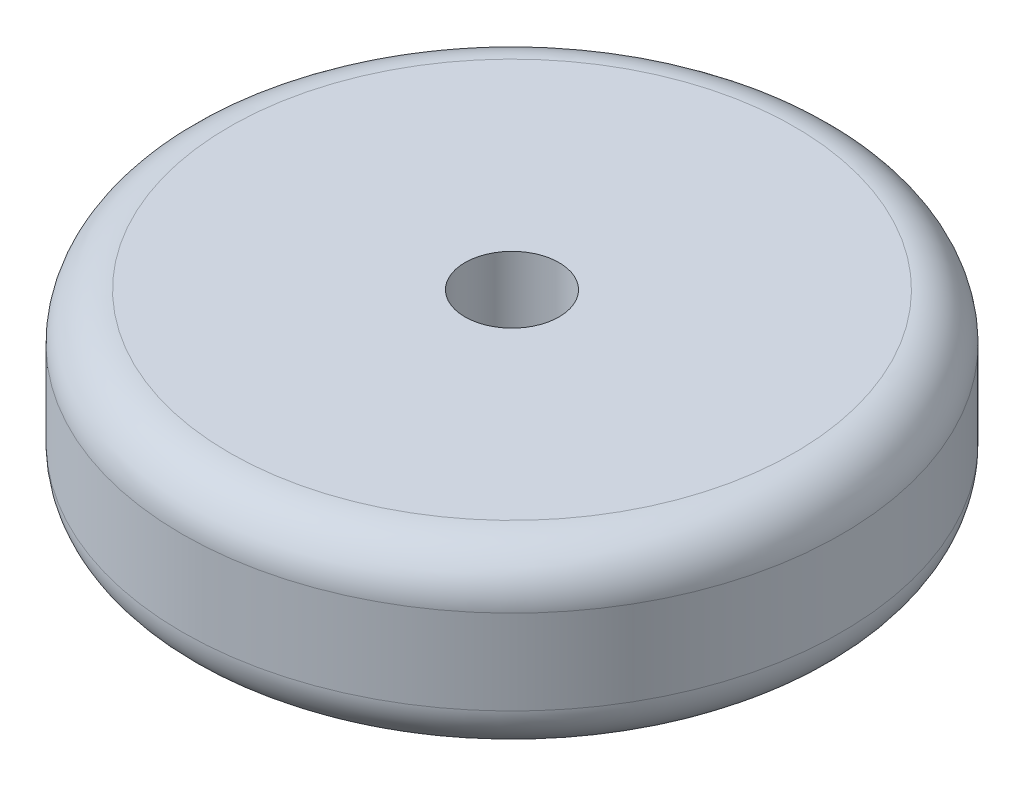
from build123d import *

# Parameters (mm, degrees)
ESBO_O1_R                = 3.5
RESSALTO_EXTRUS_O1_DEPTH = 1.9
ESBO_O2_R                = 0.5
CORTE_EXTRUS_O1_DEPTH    = 1.9
FILETE1_R                = 0.5


with BuildPart() as part:
    # Esboço1 → Ressalto-extrusão1 (new body)
    with BuildSketch(Plane(origin=(0, 0, 0), x_dir=(1, 0, 0), z_dir=(0, 1, 0))):
        with Locations(Location((0, 0, 0), (0, 0, 90))):
            Circle(ESBO_O1_R)
    extrude(amount=RESSALTO_EXTRUS_O1_DEPTH)

    # Esboço2 → Corte-extrusão1 (cut)
    with BuildSketch(Plane(origin=(0, 1.9, 0), x_dir=(1, 0, 0), z_dir=(0, 1, 0))):
        with Locations(Location((0, 0, 0), (0, 0, 270))):
            Circle(ESBO_O2_R)
    extrude(amount=-CORTE_EXTRUS_O1_DEPTH, mode=Mode.SUBTRACT)

    # Filete1
    filete1_edges = [part.edges().sort_by_distance(p)[0] for p in [
        (0, 0, 3.5),
        (0, 1.9, 3.5),
    ]]
    fillet(filete1_edges, radius=FILETE1_R)


solid = part.part
